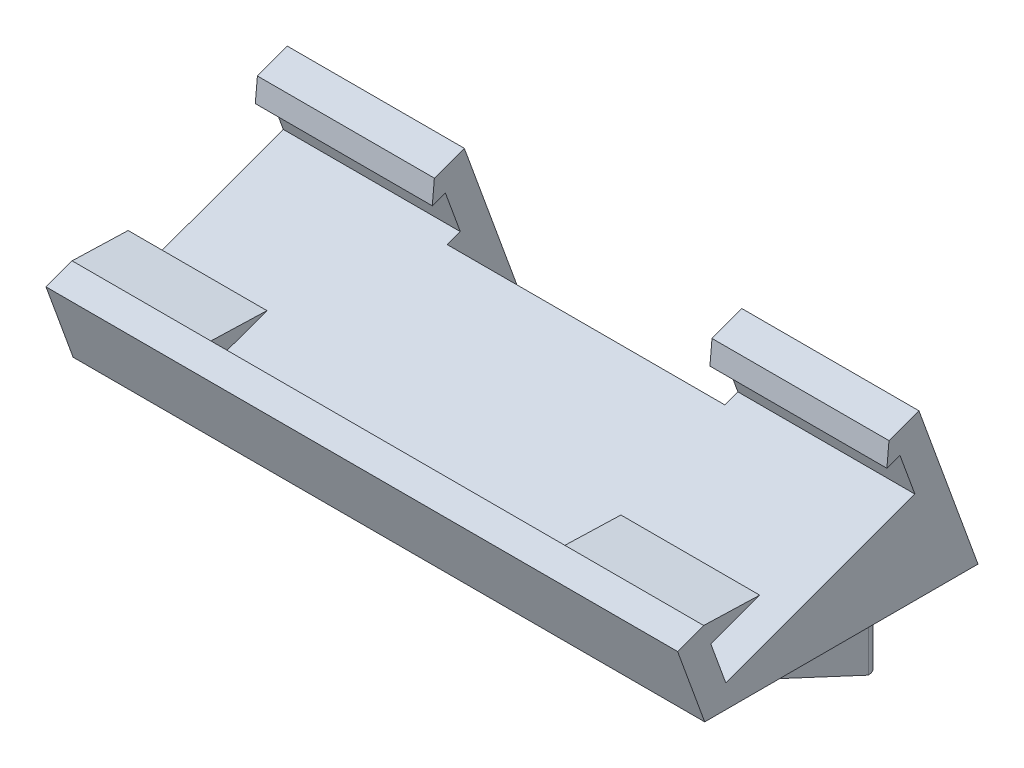
from build123d import *

# Parameters (mm, degrees)
BOSS_EXTRUDE1_DEPTH = 45.5
CUT_EXTRUDE1_REACH  = 58.087
SKETCH3_W           = 51
SKETCH3_H           = 7.5
SKETCH3_W_2         = 40
SKETCH3_H_2         = 6
BOSS_EXTRUDE2_DEPTH = 10
CUT_EXTRUDE3_DEPTH  = 93.863842547


with BuildPart() as part:
    # Sketch2 → Boss-Extrude1 (new, symmetric)
    with BuildSketch(Plane(origin=(0, 0, 0), x_dir=(0, 0, -1), z_dir=(1, 0, 0))):
        Polygon((-13.625543001, 3.368080573), (-15.780269904, 9.288144084), (-8.732575248, 11.853295159), (-16.806330334, 12.107221947), (-20.565100817, 10.739141373), (-17.384313485, 2), (-16.656373016, 0), (22.718204566, 0), (17.384313485, 14.654745303), (14.203526152, 23.393886676), (9.891430857, 21.824412342), (9.591430857, 18.522687954), (11.470816098, 19.206728241), (13.625543001, 13.28666473), align=None)
    extrude(amount=BOSS_EXTRUDE1_DEPTH, both=True)

    # Sketch3 → Cut-Extrude1 (cut, up to next)
    with BuildSketch(Plane(origin=(0, 16.092396472, 5.857153314), x_dir=(1, 0, 0), z_dir=(0, 0.9396926207859102, 0.34202014332566394)), mode=Mode.PRIVATE) as cut_extrude1_sk1:
        with Locations((0, -7.901870812)):
            Rectangle(SKETCH3_W, SKETCH3_H)
    cut_extrude1_tool1 = extrude(cut_extrude1_sk1.sketch, amount=-CUT_EXTRUDE1_REACH, mode=Mode.PRIVATE) & part.part
    # Sketch3 → Cut-Extrude1 (cut, up to next)
    with BuildSketch(Plane(origin=(0, 16.092396472, 5.857153314), x_dir=(1, 0, 0), z_dir=(0, 0.9396926207859102, 0.34202014332566394)), mode=Mode.PRIVATE) as cut_extrude1_sk2:
        with Locations((0, 18.348129188)):
            Rectangle(SKETCH3_W_2, SKETCH3_H_2)
    cut_extrude1_tool2 = extrude(cut_extrude1_sk2.sketch, amount=-CUT_EXTRUDE1_REACH, mode=Mode.PRIVATE) & part.part
    add(cut_extrude1_tool1.solids().sort_by_distance((0, 13.389797, 13.282483))[0], mode=Mode.SUBTRACT)
    add(cut_extrude1_tool2.solids().sort_by_distance((0, 22.367826, -11.384448))[0], mode=Mode.SUBTRACT)

    # Sketch4 → Boss-Extrude2 (add)
    with BuildSketch(Plane.XZ):
        with BuildLine():
            Line((41.45, 4.894084225), (41.45, -10.955915775))
            ThreePointArc((41.45, -10.955915775), (39.775, -12.630915775), (38.1, -10.955915775))
            Line((38.1, -10.955915775), (38.1, 4.894084225))
            ThreePointArc((38.1, 4.894084225), (39.775, 6.569084225), (41.45, 4.894084225))
        make_face()
        with BuildLine():
            Line((-41.45, 4.894084225), (-41.45, -10.955915775))
            ThreePointArc((-41.45, -10.955915775), (-39.775, -12.630915775), (-38.1, -10.955915775))
            Line((-38.1, -10.955915775), (-38.1, 4.894084225))
            ThreePointArc((-38.1, 4.894084225), (-39.775, 6.569084225), (-41.45, 4.894084225))
        make_face()
    extrude(amount=BOSS_EXTRUDE2_DEPTH)

    # Sketch5 → Cut-Extrude3 (cut, through all)
    with BuildSketch(Plane(origin=(41.45, 0, 0), x_dir=(0, 0, -1), z_dir=(1, 0, 0))):
        Polygon((-6.569084225, -1.827958291), (10.955915775, -10), (-6.569084225, -10), align=None)
    extrude(amount=-CUT_EXTRUDE3_DEPTH, mode=Mode.SUBTRACT)


solid = part.part
